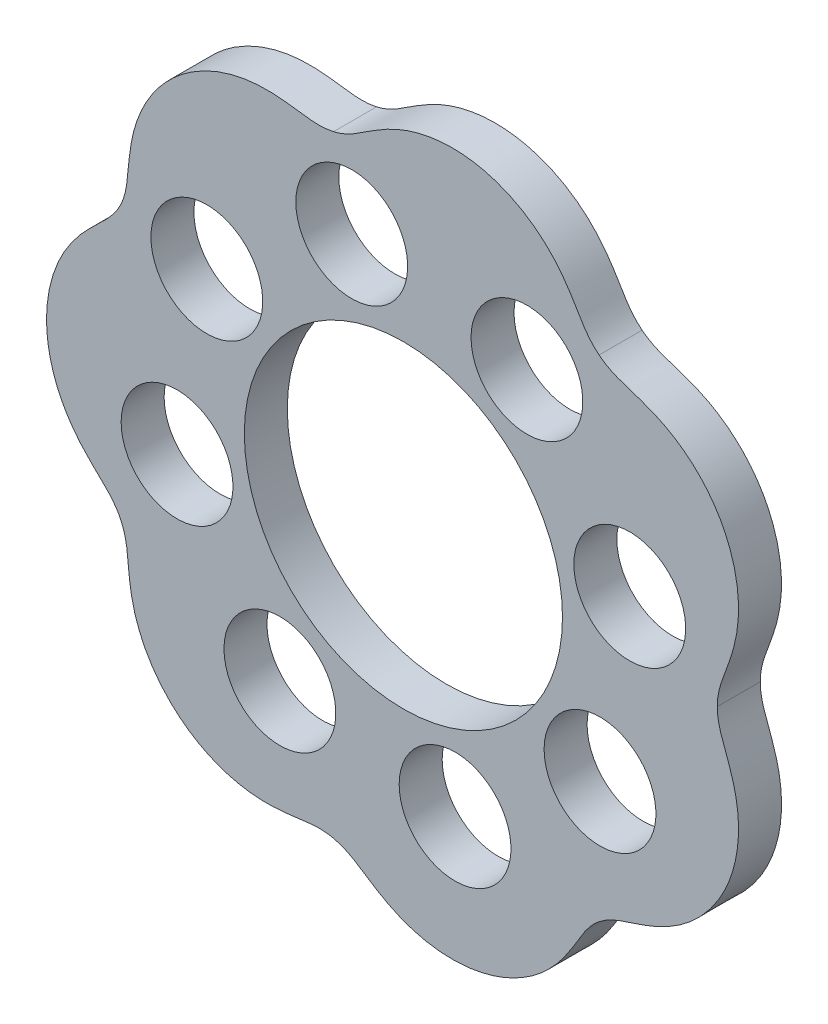
from build123d import *

# Parameters (mm, degrees)
BOSS_EXTRUDE1_DEPTH = 5
SKETCH_2_R          = 6.5
SKETCH_2_R_2        = 18.5
CUT_EXTRUDE_1_DEPTH = 59.453931515


with BuildPart() as part:
    # Sketch1 → Boss-Extrude1 (new body)
    with BuildSketch(Plane.XY):
        with BuildLine():
            add(Edge.make_bspline(
                [(22.757377772, -28.536849113), (22.893927625, -28.427954239), (23.170237205, -28.223608021), (23.792205739, -27.831190064), (24.483430721, -27.492747002), (25.246715394, -27.190394662), (26.142925149, -26.882970154), (27.123173642, -26.572717929), (28.193300358, -26.204679267), (29.202443655, -25.804196744), (30.490144535, -25.206078697), (32.003343519, -24.321190723), (33.659923311, -23.033037579), (35.623392558, -21.037807065), (37.556262354, -18.086148296), (38.658868424, -14.734605123), (38.994542018, -11.955534747), (38.968897725, -9.857272816), (38.717073216, -8.122159686), (38.382071531, -6.742902251), (38.065759728, -5.703893034), (37.686532124, -4.638198633), (37.317777206, -3.67791016), (36.999382153, -2.785931228), (36.75985001, -1.999911914), (36.593854183, -1.251859124), (36.512490543, -0.517784962), (36.5, -0.174713558), (36.5, -1e-09)],
                knots=[0.049242836, 0.049242836, 0.049242836, 0.049242836, 0.056285917, 0.063328998, 0.077415159, 0.09150132, 0.105587482, 0.133759804, 0.161932127, 0.19010445, 0.218276773, 0.274621418, 0.330966064, 0.387310709, 0.5, 0.612689291, 0.669033936, 0.725378582, 0.781723227, 0.80989555, 0.838067873, 0.866240196, 0.894412518, 0.90849868, 0.922584841, 0.936671002, 0.943714083, 0.950757164, 0.950757164, 0.950757164, 0.950757164], degree=3))
            add(Edge.make_bspline(
                [(36.5, -1e-09), (36.5, 0.174653817), (36.512511899, 0.518089129), (36.593498224, 1.249032304), (36.75986451, 2.000469553), (36.999376141, 2.785743142), (37.317799625, 3.678104189), (37.686409607, 4.63793242), (38.065878488, 5.704059529), (38.381959198, 6.742736298), (38.717200046, 8.122421888), (38.968830904, 9.857207121), (38.994572829, 11.955523704), (38.65884185, 14.734631654), (37.556266705, 18.086139253), (35.623388379, 21.03784438), (33.65991273, 23.033006602), (32.003436538, 24.321202002), (30.489860455, 25.206143016), (29.202643436, 25.804181096), (28.193096136, 26.204690221), (27.123458159, 26.572647733), (26.142759468, 26.883073598), (25.246866189, 27.19028209), (24.482985696, 27.493083346), (23.794637768, 27.829705868), (23.169986078, 28.223780967), (22.893974327, 28.427916989), (22.757377768, 28.53684911)],
                knots=[0.049242836, 0.049242836, 0.049242836, 0.049242836, 0.056285917, 0.063328998, 0.077415159, 0.09150132, 0.105587482, 0.133759804, 0.161932127, 0.19010445, 0.218276773, 0.274621418, 0.330966064, 0.387310709, 0.5, 0.612689291, 0.669033936, 0.725378582, 0.781723227, 0.80989555, 0.838067873, 0.866240196, 0.894412518, 0.90849868, 0.922584841, 0.936671002, 0.943714083, 0.950757164, 0.950757164, 0.950757164, 0.950757164], degree=3))
            add(Edge.make_bspline(
                [(22.757377768, 28.53684911), (22.620832651, 28.645739731), (22.360124621, 28.869649837), (21.839143201, 29.388702102), (21.355372251, 29.987285048), (20.890752224, 30.664151961), (20.3916083, 31.469482523), (19.871006979, 32.356115532), (19.274068053, 33.317514492), (18.659068897, 34.212239533), (17.789403892, 35.334559572), (16.589980381, 36.612910988), (14.96549693, 37.941312436), (12.583374174, 39.411567729), (9.275612144, 40.639163175), (5.762744736, 40.968327848), (2.978657205, 40.677177308), (0.938710259, 40.1852637), (-0.696862539, 39.553649811), (-1.966993013, 38.920130381), (-2.909565132, 38.380545399), (-3.864153324, 37.773683957), (-4.718309307, 37.200487793), (-5.517075065, 36.691589411), (-6.230087722, 36.283155131), (-6.922447402, 35.95486293), (-7.620015956, 35.71219083), (-7.95170017, 35.623674735), (-8.122031107, 35.584797429)],
                knots=[0.049242836, 0.049242836, 0.049242836, 0.049242836, 0.056285918, 0.063329, 0.077415165, 0.091501329, 0.105587493, 0.133759821, 0.16193215, 0.190104478, 0.218276806, 0.274621463, 0.33096612, 0.387310777, 0.50000009, 0.612689403, 0.66903406, 0.725378717, 0.781723374, 0.809895702, 0.83806803, 0.866240359, 0.894412687, 0.908498851, 0.922585015, 0.93667118, 0.943714262, 0.950757344, 0.950757344, 0.950757344, 0.950757344], degree=3))
            add(Edge.make_bspline(
                [(-8.122031107, 35.584797429), (-8.292303944, 35.545934241), (-8.629906203, 35.481712141), (-9.360549053, 35.3980177), (-10.130165973, 35.393003612), (-10.949049596, 35.451771934), (-11.889894101, 35.563645227), (-12.90768147, 35.709434371), (-14.031518414, 35.842156881), (-15.114488006, 35.919188703), (-16.534180306, 35.939019714), (-18.281464597, 35.79832091), (-20.332901658, 35.356504225), (-22.967627485, 34.410788871), (-25.989765467, 32.590085845), (-28.437367065, 30.048859636), (-29.945599067, 27.690651276), (-30.832901756, 25.789058383), (-31.358858011, 24.116514309), (-31.65547332, 22.728495317), (-31.821298503, 21.655138296), (-31.942016841, 20.530440601), (-32.026436404, 19.50525442), (-32.126589777, 18.563463634), (-32.251821439, 17.751356674), (-32.42683362, 17.005362538), (-32.672031259, 16.30868321), (-32.809631405, 15.994167159), (-32.885437034, 15.836755763)],
                knots=[0.049242656, 0.049242656, 0.049242656, 0.049242656, 0.056285738, 0.063328819, 0.077414982, 0.091501144, 0.105587307, 0.133759632, 0.161931958, 0.190104283, 0.218276609, 0.274621259, 0.33096591, 0.387310561, 0.499999863, 0.612689164, 0.669033815, 0.725378466, 0.781723116, 0.809895442, 0.838067767, 0.866240093, 0.894412418, 0.908498581, 0.922584743, 0.936670906, 0.943713988, 0.950757069, 0.950757069, 0.950757069, 0.950757069], degree=3))
            add(Edge.make_bspline(
                [(-32.885437034, 15.836755763), (-32.961216335, 15.67939802), (-33.121499885, 15.375401836), (-33.511609224, 14.751983794), (-33.987535131, 14.147145699), (-34.544043418, 13.543558598), (-35.218112181, 12.877727047), (-35.966670266, 12.17288432), (-36.77113312, 11.37698078), (-37.506575004, 10.578306089), (-38.407237057, 9.48070597), (-39.386640277, 8.026894927), (-40.32025399, 6.147544075), (-41.223574455, 3.497984339), (-41.684345289, -9.761e-06), (-41.22357121, -3.498047262), (-40.320203472, -6.147544192), (-39.386693006, -8.026883982), (-38.406966526, -9.480902052), (-37.506700775, -10.578216222), (-36.77090283, -11.377086974), (-35.966841455, -12.172701972), (-35.21794975, -12.877893584), (-34.544069197, -13.543390927), (-33.987215954, -14.147639542), (-33.513089709, -14.749587875), (-33.12127947, -15.375662595), (-32.961172148, -15.679339431), (-32.885366449, -15.836750728)],
                knots=[0.049242931, 0.049242931, 0.049242931, 0.049242931, 0.056286011, 0.063329091, 0.077415251, 0.091501411, 0.105587571, 0.13375989, 0.16193221, 0.19010453, 0.21827685, 0.274621489, 0.330966129, 0.387310768, 0.500000047, 0.612689326, 0.669033966, 0.725378606, 0.781723245, 0.809895565, 0.838067885, 0.866240204, 0.894412524, 0.908498684, 0.922584844, 0.936671004, 0.943714084, 0.950757164, 0.950757164, 0.950757164, 0.950757164], degree=3))
            add(Edge.make_bspline(
                [(-32.885366449, -15.836750728), (-32.809584225, -15.994114138), (-32.67184606, -16.308967371), (-32.427667859, -17.002663066), (-32.2515223, -17.75186826), (-32.126597382, -18.563295518), (-32.026306081, -19.505443812), (-31.941958336, -20.530153044), (-31.821272768, -21.655345755), (-31.655386687, -22.728303468), (-31.358805111, -24.116812785), (-30.832821578, -25.78897881), (-29.945588805, -27.690665729), (-28.437295896, -30.04888726), (-25.989745367, -32.59010184), (-22.967585312, -34.410851791), (-20.332886434, -35.356510683), (-18.281525917, -35.79841655), (-16.533879472, -35.939004802), (-15.114658013, -35.91931596), (-14.031312928, -35.842136056), (-12.90795163, -35.709555794), (-11.889683905, -35.563730619), (-10.949219183, -35.451802381), (-10.129606098, -35.39318156), (-9.363371007, -35.397805001), (-8.629596503, -35.481828185), (-8.292347209, -35.545991375), (-8.122014085, -35.584868799)],
                knots=[0.049242836, 0.049242836, 0.049242836, 0.049242836, 0.056285917, 0.063328998, 0.077415159, 0.09150132, 0.105587482, 0.133759804, 0.161932127, 0.19010445, 0.218276773, 0.274621418, 0.330966064, 0.387310709, 0.5, 0.612689291, 0.669033936, 0.725378582, 0.781723227, 0.80989555, 0.838067873, 0.866240196, 0.894412518, 0.90849868, 0.922584841, 0.936671002, 0.943714083, 0.950757164, 0.950757164, 0.950757164, 0.950757164], degree=3))
            add(Edge.make_bspline(
                [(-8.122014085, -35.584868799), (-7.951739203, -35.62373293), (-7.619698691, -35.712352675), (-6.92510294, -35.953958662), (-6.229525773, -36.283364316), (-5.517236985, -36.691610703), (-4.718105183, -37.20061966), (-3.864365287, -37.773569694), (-2.909407981, -38.380760098), (-1.967107582, -38.920043329), (-0.696611696, -39.553887915), (0.938685715, -40.185235892), (2.978665004, -40.677251779), (5.762802086, -40.968347973), (9.275626443, -40.63919729), (12.583432051, -39.41159644), (14.965485825, -37.941314587), (16.589984107, -36.613020155), (17.789540165, -35.334310484), (18.659016915, -34.212442676), (19.274129849, -33.317328499), (19.870878739, -32.356386828), (20.391747568, -31.469352555), (20.890608711, -30.664281511), (21.355797508, -29.986932714), (21.837152024, -29.390748665), (22.360344915, -28.869448256), (22.620781213, -28.645781234), (22.757377772, -28.536849113)],
                knots=[0.049242836, 0.049242836, 0.049242836, 0.049242836, 0.056285917, 0.063328998, 0.077415159, 0.09150132, 0.105587482, 0.133759804, 0.161932127, 0.19010445, 0.218276773, 0.274621418, 0.330966064, 0.387310709, 0.5, 0.612689291, 0.669033936, 0.725378582, 0.781723227, 0.80989555, 0.838067873, 0.866240196, 0.894412518, 0.90849868, 0.922584841, 0.936671002, 0.943714083, 0.950757164, 0.950757164, 0.950757164, 0.950757164], degree=3))
        make_face()
    extrude(amount=-BOSS_EXTRUDE1_DEPTH)

    # ｽｹｯﾁ2 → ｶｯﾄ - 押し出し1 (cut, through all)
    with BuildSketch(Plane(origin=(0, 0, -5), x_dir=(-1, 0, 0), z_dir=(0, 0, -1))):
        with Locations((6.008086331, 26.32304881)):
            Circle(SKETCH_2_R)
        with Locations((22.861564901, 14.364847729)):
            Circle(SKETCH_2_R)
        with Locations((26.32304881, -6.008086331)):
            Circle(SKETCH_2_R)
        with Locations((14.364847729, -22.861564901)):
            Circle(SKETCH_2_R)
        with Locations((-6.008086331, -26.32304881)):
            Circle(SKETCH_2_R)
        with Locations((-22.861564901, -14.364847729)):
            Circle(SKETCH_2_R)
        with Locations((-26.32304881, 6.008086331)):
            Circle(SKETCH_2_R)
        with Locations((-14.364847729, 22.861564901)):
            Circle(SKETCH_2_R)
        Circle(SKETCH_2_R_2)
    extrude(amount=-CUT_EXTRUDE_1_DEPTH, mode=Mode.SUBTRACT)


solid = part.part
